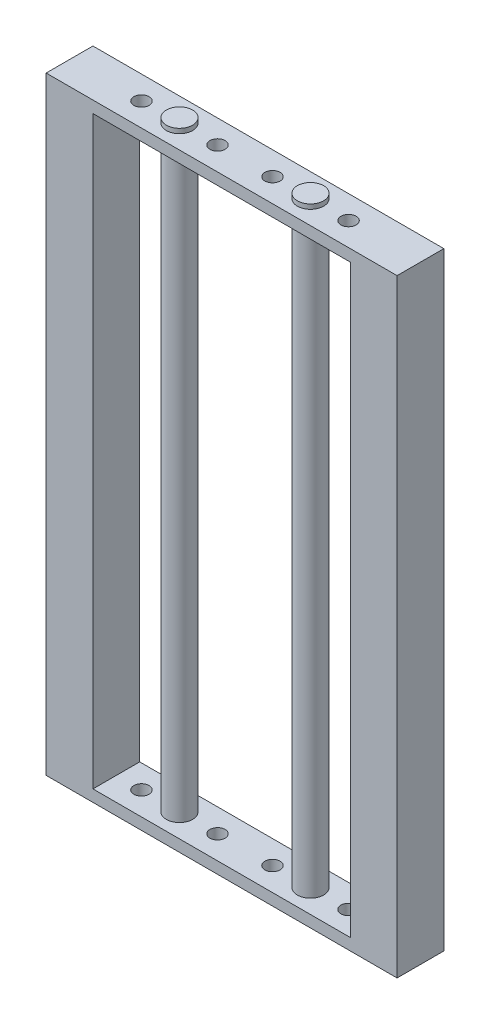
from build123d import *

# Parameters (mm, degrees)
BOSS_EXTRUDE1_DEPTH = 20
SKETCH2_R           = 5.612511992
BOSS_EXTRUDE2_DEPTH = 262
SKETCH3_R           = 3.25
CUT_EXTRUDE1_DEPTH  = 10
SKETCH4_R           = 3.25
CUT_EXTRUDE2_DEPTH  = 10


with BuildPart() as part:
    # Sketch1 → Boss-Extrude1 (new body)
    with BuildSketch(Plane.XY):
        Polygon((-75, -125), (-75, 125), (-75, 130), (-63.356925632, 130), (75, 130), (75, 125), (75, -125), (75, -130), (-75, -130), align=None)
        Polygon((-55, -105), (-55, 105), (-55, 125), (55, 125), (55, 105), (55, -105), (55, -125), (-55, -125), align=None, mode=Mode.SUBTRACT)
    extrude(amount=BOSS_EXTRUDE1_DEPTH)

    # Sketch2 → Boss-Extrude2 (add)
    with BuildSketch(Plane.XZ.offset(130)):
        with Locations(Location((-28, 10, 0), (0, 0, 90))):
            Circle(SKETCH2_R)
        with Locations(Location((28, 10, 0), (0, 0, 90))):
            Circle(SKETCH2_R)
    extrude(amount=-BOSS_EXTRUDE2_DEPTH)

    # Sketch3 → Cut-Extrude1 (cut)
    with BuildSketch(Plane.XZ.offset(-125)):
        with Locations(Location((-44.25, 10, 0), (0, 0, 270))):
            Circle(SKETCH3_R)
        with Locations(Location((-11.75, 10, 0), (0, 0, 270))):
            Circle(SKETCH3_R)
        with Locations(Location((11.75, 10, 0), (0, 0, 270))):
            Circle(SKETCH3_R)
        with Locations(Location((44.25, 10, 0), (0, 0, 270))):
            Circle(SKETCH3_R)
    extrude(amount=-CUT_EXTRUDE1_DEPTH, mode=Mode.SUBTRACT)

    # Sketch4 → Cut-Extrude2 (cut)
    with BuildSketch(Plane.XZ.offset(130)):
        with Locations(Location((-44.25, 10, 0), (0, 0, 270))):
            Circle(SKETCH4_R)
        with Locations(Location((-11.75, 10, 0), (0, 0, 270))):
            Circle(SKETCH4_R)
        with Locations(Location((11.75, 10, 0), (0, 0, 270))):
            Circle(SKETCH4_R)
        with Locations(Location((44.25, 10, 0), (0, 0, 270))):
            Circle(SKETCH4_R)
    extrude(amount=-CUT_EXTRUDE2_DEPTH, mode=Mode.SUBTRACT)


solid = part.part
